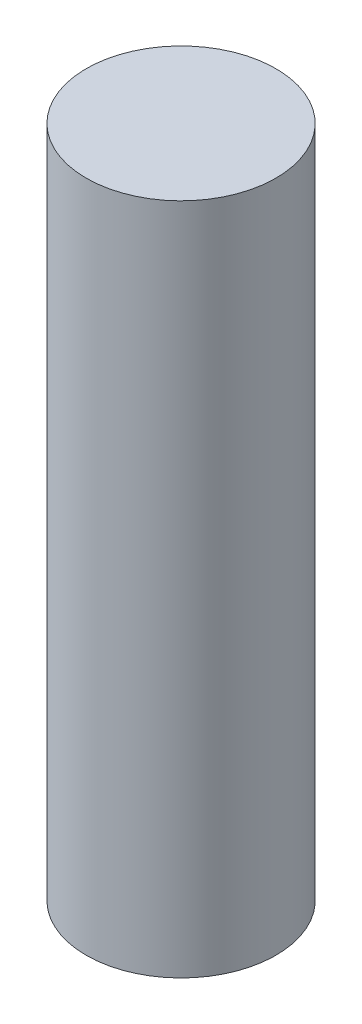
from build123d import *

# Parameters (mm, degrees)
SKETCH1_R           = 4.75
BOSS_EXTRUDE1_DEPTH = 33.7
SKETCH2_R           = 3.25
CUT_EXTRUDE1_DEPTH  = 17


with BuildPart() as part:
    # Sketch1 → Boss-Extrude1 (new body)
    with BuildSketch(Plane(origin=(0, 0, 0), x_dir=(1, 0, 0), z_dir=(0, 1, 0))):
        with Locations(Location((0, 0, 0), (0, 0, 270))):
            Circle(SKETCH1_R)
    extrude(amount=BOSS_EXTRUDE1_DEPTH)

    # Sketch2 → Cut-Extrude1 (cut)
    with BuildSketch(Plane.XZ):
        with Locations(Location((0, 0, 0), (0, 0, 270))):
            Circle(SKETCH2_R)
    extrude(amount=-CUT_EXTRUDE1_DEPTH, mode=Mode.SUBTRACT)


solid = part.part
